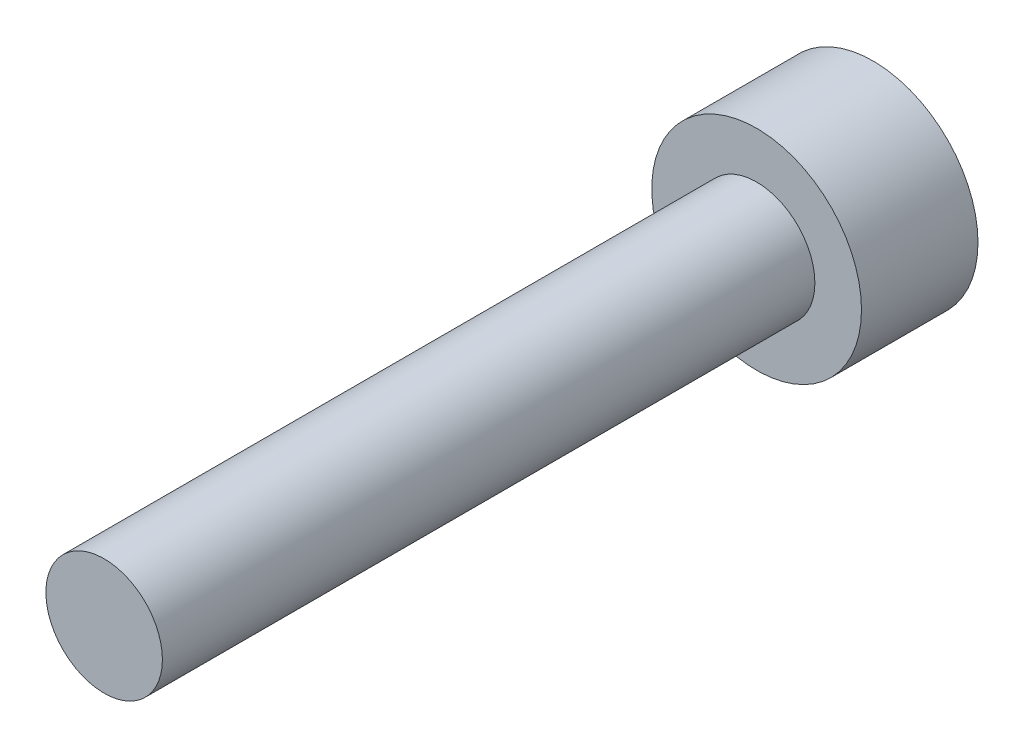
from build123d import *

# Parameters (mm, degrees)
CABEZA_START            = -2.5
CROQUIS1_R              = 2.25
CABEZA_DEPTH            = 2.5
CROQUIS2_R              = 1.25
CUERPO_DEPTH            = 14
HEXAGONO_INTERIOR_START = -2.5
HEXAGONO_INTERIOR_DEPTH = 1.1


with BuildPart() as part:
    # Croquis1 → Cabeza (new body)
    with BuildSketch(Plane.XY.offset(CABEZA_START)):
        Circle(CROQUIS1_R)
    extrude(amount=CABEZA_DEPTH)

    # Croquis2 → Cuerpo (add)
    with BuildSketch(Plane.XY):
        Circle(CROQUIS2_R)
    extrude(amount=CUERPO_DEPTH)

    # Croquis3 → Hexagono_interior (cut)
    with BuildSketch(Plane.XY.offset(HEXAGONO_INTERIOR_START)):
        Polygon((1.154700538, 0), (0.577350269, 1), (-0.577350269, 1), (-1.154700538, 0), (-0.577350269, -1), (0.577350269, -1), align=None)
    extrude(amount=HEXAGONO_INTERIOR_DEPTH, mode=Mode.SUBTRACT)


solid = part.part
